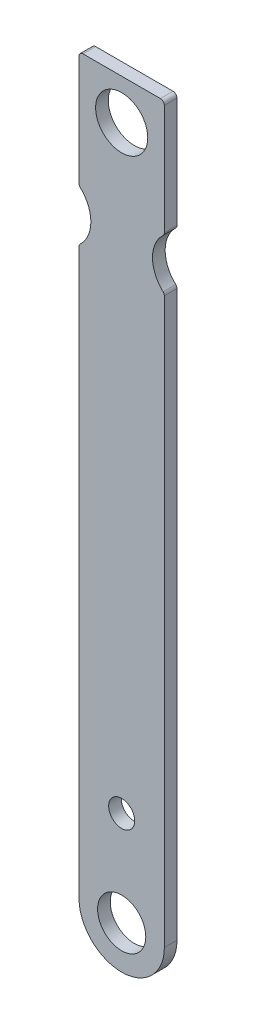
from build123d import *

# Parameters (mm, degrees)
SKETCH_2_R      = 1.525
SKETCH_2_R_2    = 0.825
SKETCH_2_R_3    = 1.65
EXTRUDE_1_DEPTH = 0.8


with BuildPart() as part:
    # 草图2 → 凸台-拉伸1 (new body)
    with BuildSketch(Plane.XY):
        with BuildLine():
            Line((2.45, 46.401), (-2.45, 46.401))
            ThreePointArc((-2.45, 46.401), (-2.626776695, 46.327776695), (-2.7, 46.151))
            Line((-2.7, 46.151), (-2.7, 39.169281101))
            ThreePointArc((-2.7, 39.169281101), (-2.679315634, 39.069710321), (-2.620685279, 38.98661601))
            ThreePointArc((-2.620685279, 38.98661601), (-1.95, 37.442), (-2.620685279, 35.897383991))
            ThreePointArc((-2.620685279, 35.897383991), (-2.679315634, 35.814289679), (-2.7, 35.7147189))
            Line((-2.7, 35.7147189), (-2.7, 0))
            ThreePointArc((-2.7, 0), (0, -2.7), (2.7, 0))
            Line((2.7, 0), (2.7, 35.7147189))
            ThreePointArc((2.7, 35.7147189), (2.679315634, 35.814289679), (2.620685279, 35.897383991))
            ThreePointArc((2.620685279, 35.897383991), (1.95, 37.442), (2.620685279, 38.98661601))
            ThreePointArc((2.620685279, 38.98661601), (2.679315634, 39.069710321), (2.7, 39.169281101))
            Line((2.7, 39.169281101), (2.7, 46.151))
            ThreePointArc((2.7, 46.151), (2.626776695, 46.327776695), (2.45, 46.401))
        make_face()
        Circle(SKETCH_2_R, mode=Mode.SUBTRACT)
        with Locations((0, 6)):
            Circle(SKETCH_2_R_2, mode=Mode.SUBTRACT)
        with Locations((0, 43.851)):
            Circle(SKETCH_2_R_3, mode=Mode.SUBTRACT)
    extrude(amount=EXTRUDE_1_DEPTH)


solid = part.part
